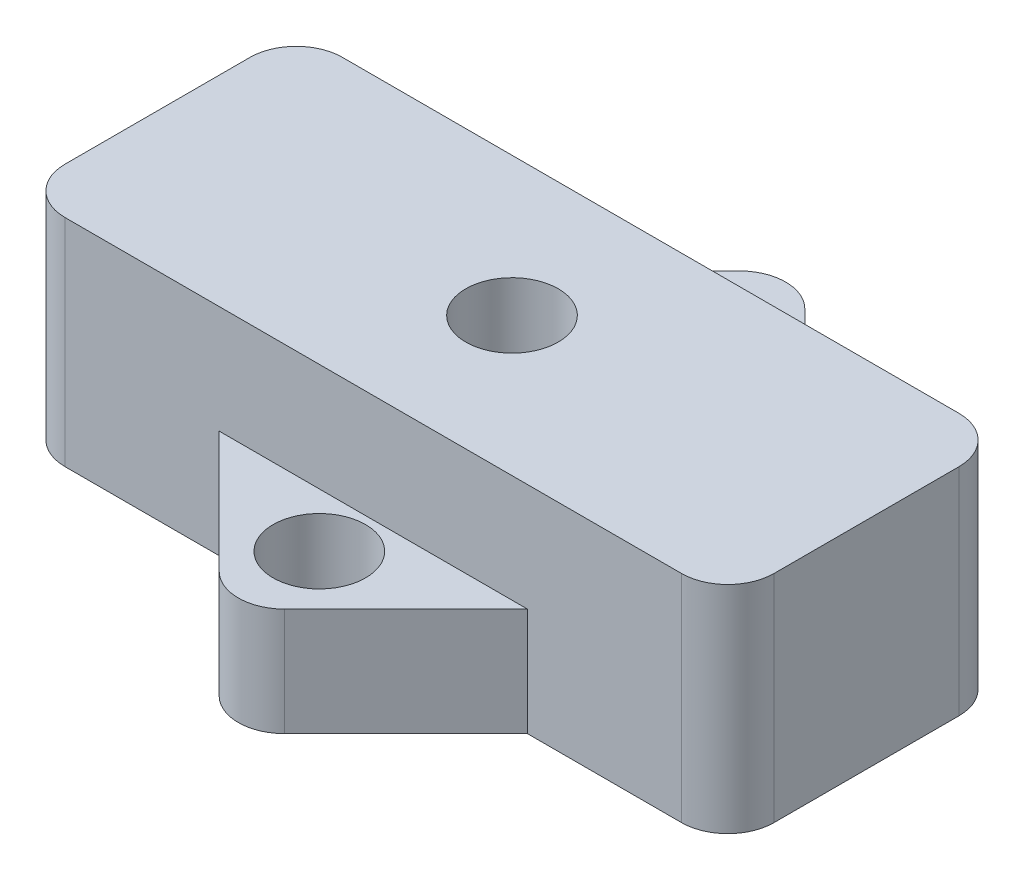
from build123d import *

# Parameters (mm, degrees)
BOX_DEPTH          = 14
TRIANGLE_DEPTH     = 7
SKETCH4_R          = 3
CUT_EXTRUDE1_DEPTH = 33.25405106


with BuildPart() as part:
    # Sketch1 → box (new body)
    with BuildSketch(Plane(origin=(0, 0, 0), x_dir=(1, 0, 0), z_dir=(0, 1, 0))):
        with BuildLine():
            Line((-20, -9), (20, -9))
            ThreePointArc((20, -9), (22.121320344, -8.121320344), (23, -6))
            Line((23, -6), (23, 6))
            ThreePointArc((23, 6), (22.121320344, 8.121320344), (20, 9))
            Line((20, 9), (-20, 9))
            ThreePointArc((-20, 9), (-22.121320344, 8.121320344), (-23, 6))
            Line((-23, 6), (-23, -6))
            ThreePointArc((-23, -6), (-22.121320344, -8.121320344), (-20, -9))
        make_face()
    extrude(amount=BOX_DEPTH)

    # Sketch3 → triangle (add)
    with BuildSketch(Plane.XZ):
        with BuildLine():
            Line((-10, -9), (-2.121320344, -16.878679656))
            ThreePointArc((-2.121320344, -16.878679656), (0, -17.757359313), (2.121320344, -16.878679656))
            Line((2.121320344, -16.878679656), (10, -9))
            Line((10, -9), (-10, -9))
        make_face()
        with BuildLine():
            Line((2.121320344, 16.878679656), (10, 9))
            Line((10, 9), (-10, 9))
            Line((-10, 9), (-2.121320344, 16.878679656))
            ThreePointArc((-2.121320344, 16.878679656), (0, 17.757359313), (2.121320344, 16.878679656))
        make_face()
    extrude(amount=-TRIANGLE_DEPTH)

    # Sketch4 → Cut-Extrude1 (cut, through all)
    with BuildSketch(Plane.XZ):
        with Locations(Location((0, 12.5, 0), (0, 0, 270))):
            Circle(SKETCH4_R)
        with Locations(Location((0, 0, 0), (0, 0, 270))):
            Circle(SKETCH4_R)
        with Locations(Location((0, -12.5, 0), (0, 0, 270))):
            Circle(SKETCH4_R)
    extrude(amount=-CUT_EXTRUDE1_DEPTH, mode=Mode.SUBTRACT)


solid = part.part
